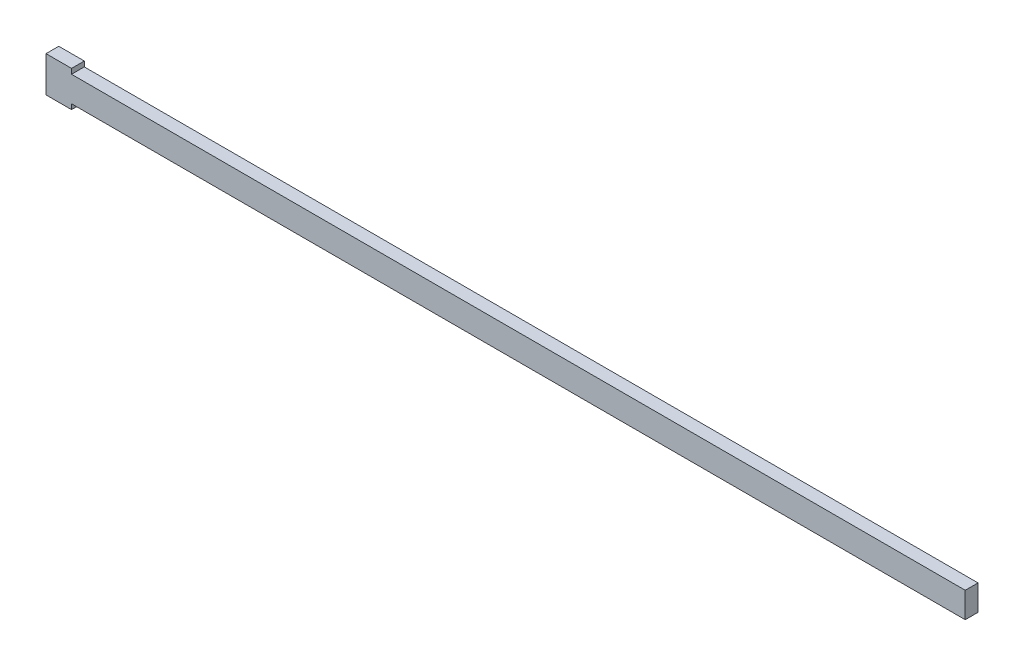
from build123d import *

# Parameters (mm, degrees)
BOSS_EXTRUDE1_DEPTH = 6.35


with BuildPart() as part:
    # Sketch1 → Boss-Extrude1 (new body)
    with BuildSketch(Plane.XY):
        Polygon((12.7, 0), (457.2, 0), (457.2, 12.7), (12.7, 12.7), (12.7, 15.24), (0, 15.24), (0, 12.7), (0, 0), (0, -2.54), (12.7, -2.54), align=None)
    extrude(amount=BOSS_EXTRUDE1_DEPTH)


solid = part.part
